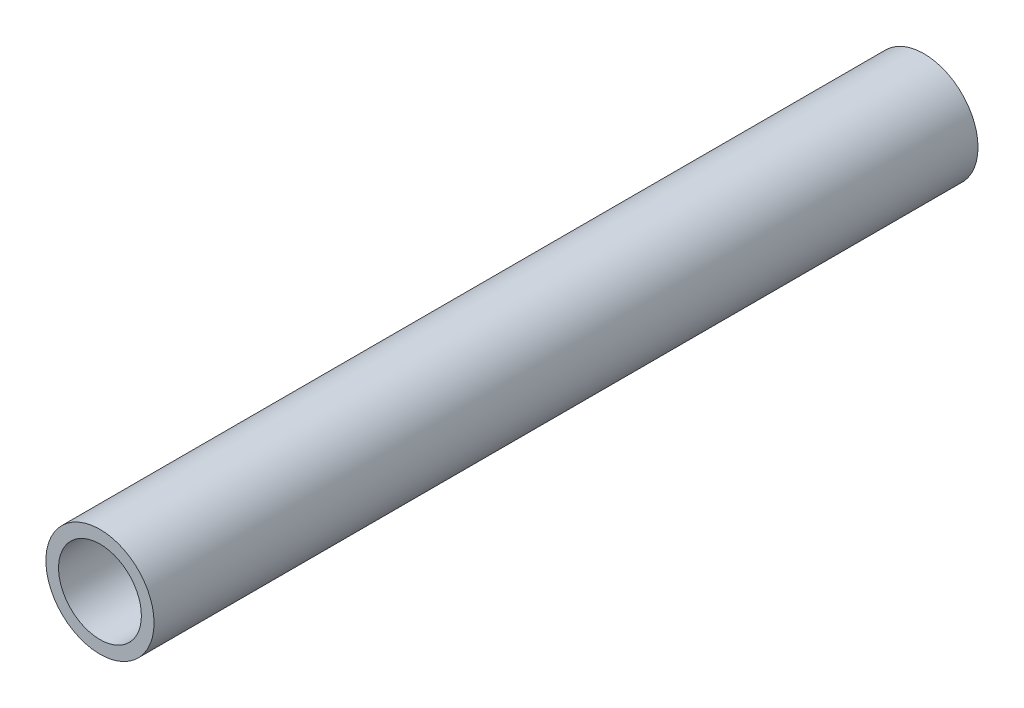
from build123d import *

# Parameters (mm, degrees)
SKETCH1_R           = 13.335
SKETCH1_R_2         = 10.2108
BOSS_EXTRUDE1_DEPTH = 101.6


with BuildPart() as part:
    # Sketch1 → Boss-Extrude1 (new, symmetric)
    with BuildSketch(Plane.XY):
        Circle(SKETCH1_R)
        Circle(SKETCH1_R_2, mode=Mode.SUBTRACT)
    extrude(amount=BOSS_EXTRUDE1_DEPTH, both=True)


solid = part.part
